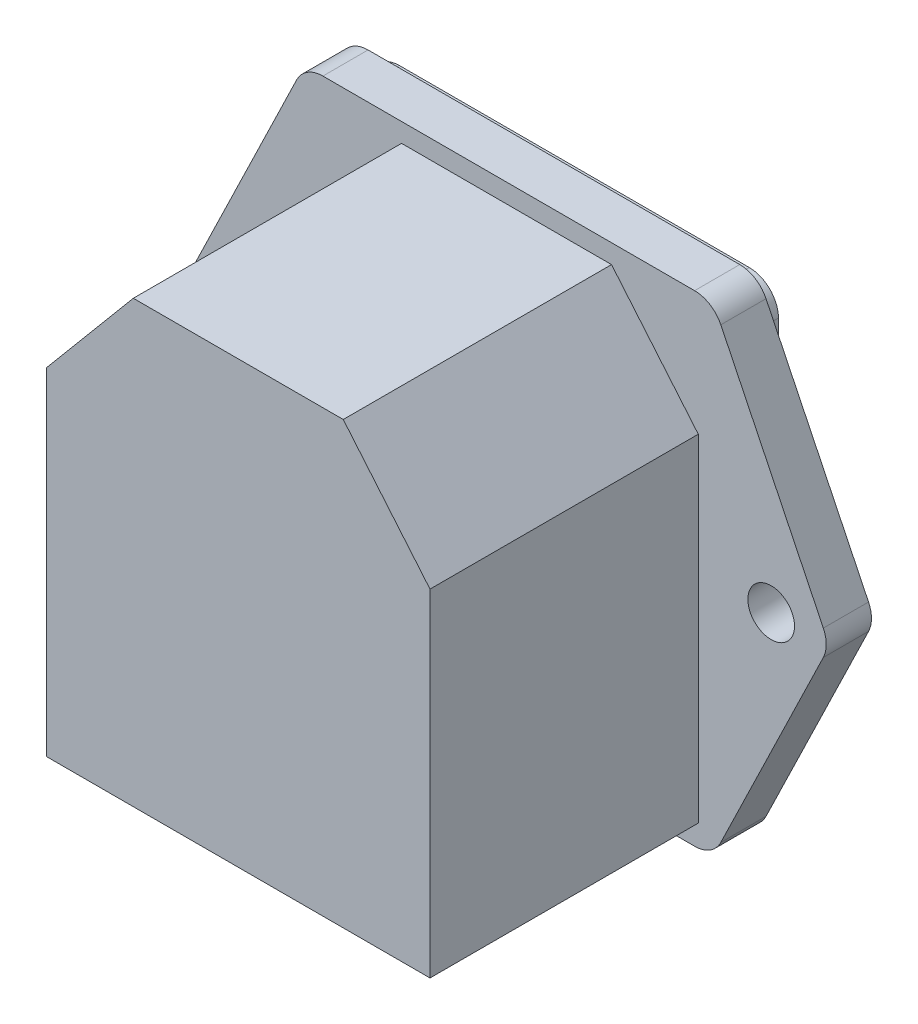
from build123d import *

# Parameters (mm, degrees)
SKETCH1_W           = 26.3
SKETCH1_H           = 30.2
BOSS_EXTRUDE1_DEPTH = 21.5
CUT_EXTRUDE1_DEPTH  = 26
SKETCH3_W           = 44
SKETCH3_H           = 33
BOSS_EXTRUDE2_DEPTH = 3.1
CUT_EXTRUDE2_DEPTH  = 3.1
FILLET1_R           = 2
SKETCH5_W           = 28
SKETCH5_H           = 30.5
BOSS_EXTRUDE3_DEPTH = 1.4
FILLET2_R           = 2
SKETCH6_W           = 2
SKETCH6_H           = 2
CUT_EXTRUDE3_DEPTH  = 20
SKETCH7_R           = 1.6
CUT_EXTRUDE4_DEPTH  = 20


with BuildPart() as part:
    # Sketch1 → Boss-Extrude1 (new body)
    with BuildSketch(Plane.XY):
        with Locations((13.15, 15.1)):
            Rectangle(SKETCH1_W, SKETCH1_H)
    extrude(amount=BOSS_EXTRUDE1_DEPTH)

    # Sketch2 → Cut-Extrude1 (cut)
    with BuildSketch(Plane.XY.offset(21.5)):
        Polygon((0, 30.2), (0, 23.1), (5.95, 30.2), align=None)
        Polygon((20.35, 30.2), (26.3, 23.1), (26.3, 30.2), align=None)
    extrude(amount=-CUT_EXTRUDE1_DEPTH, mode=Mode.SUBTRACT)

    # Sketch3 → Boss-Extrude2 (add)
    with BuildSketch(Plane(origin=(0, 0, 0), x_dir=(-1, 0, 0), z_dir=(0, 0, -1))):
        with Locations((-13.3, 15)):
            Rectangle(SKETCH3_W, SKETCH3_H)
    extrude(amount=-BOSS_EXTRUDE2_DEPTH)

    # Sketch4 → Cut-Extrude2 (cut)
    with BuildSketch(Plane(origin=(0, 0, 0), x_dir=(-1, 0, 0), z_dir=(0, 0, -1))):
        Polygon((-35.3, 15), (-27.3, 31.5), (-35.3, 31.5), align=None)
        Polygon((8.7, 31.5), (0.7, 31.5), (8.7, 15), align=None)
        Polygon((8.7, -1.5), (8.7, 15), (0.7, -1.5), align=None)
        Polygon((-27.3, -1.5), (-35.3, 15), (-35.3, -1.5), align=None)
    extrude(amount=-CUT_EXTRUDE2_DEPTH, mode=Mode.SUBTRACT)

    # Fillet1
    fillet1_edges = [part.edges().sort_by_distance(p)[0] for p in [
        (27.3, 31.5, 1.55),
        (35.3, 15, 1.55),
        (-0.7, 31.5, 1.55),
        (-8.7, 15, 1.55),
        (-0.7, -1.5, 1.55),
        (27.3, -1.5, 1.55),
    ]]
    fillet(fillet1_edges, radius=FILLET1_R)

    # Sketch5 → Boss-Extrude3 (add)
    with BuildSketch(Plane(origin=(0, 0, 0), x_dir=(-1, 0, 0), z_dir=(0, 0, -1))):
        with Locations((-13.3, 15)):
            Rectangle(SKETCH5_W, SKETCH5_H)
    extrude(amount=BOSS_EXTRUDE3_DEPTH)

    # Fillet2
    fillet2_edges = [part.edges().sort_by_distance(p)[0] for p in [
        (-0.7, -0.25, -0.7),
        (-0.7, 30.25, -0.7),
        (27.3, 30.25, -0.7),
        (27.3, -0.25, -0.7),
    ]]
    fillet(fillet2_edges, radius=FILLET2_R)

    # Sketch6 → Cut-Extrude3 (cut)
    with BuildSketch(Plane(origin=(0, 0, -1.4), x_dir=(-1, 0, 0), z_dir=(0, 0, -1))):
        Polygon((-25.3, 24.25), (-25.3, 11.45), (-1.3, 11.45), (-1.3, 24.25), (-5.55, 28.45), (-21.05, 28.45), align=None)
        with Locations((-19.3, 18.45)):
            Rectangle(SKETCH6_W, SKETCH6_H, mode=Mode.SUBTRACT)
        with Locations((-7.3, 18.45)):
            Rectangle(SKETCH6_W, SKETCH6_H, mode=Mode.SUBTRACT)
        with Locations((-13.673670814, 23.25)):
            Rectangle(SKETCH6_W, SKETCH6_H, mode=Mode.SUBTRACT)
    extrude(amount=-CUT_EXTRUDE3_DEPTH, mode=Mode.SUBTRACT)

    # Sketch7 → Cut-Extrude4 (cut)
    with BuildSketch(Plane(origin=(0, 0, 0), x_dir=(-1, 0, 0), z_dir=(0, 0, -1))):
        with Locations((-31.3, 15)):
            Circle(SKETCH7_R)
        with Locations((4.7, 15)):
            Circle(SKETCH7_R)
    extrude(amount=-CUT_EXTRUDE4_DEPTH, mode=Mode.SUBTRACT)


solid = part.part
